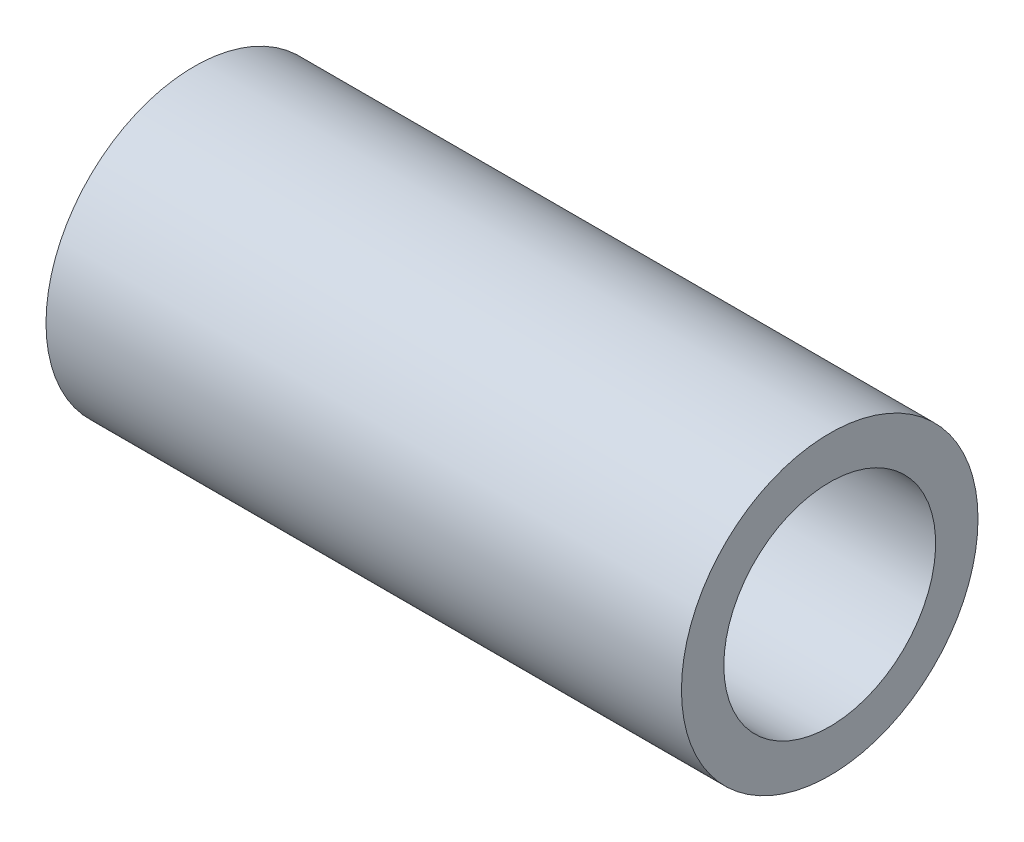
from build123d import *

# Parameters (mm, degrees)
SKIZZE1_W = 30
SKIZZE1_H = 2


with BuildPart() as part:
    # Skizze1 → Rotation1 (revolve)
    with BuildSketch(Plane.XY, mode=Mode.PRIVATE) as rotation1_sk:
        with Locations((15, 6)):
            Rectangle(SKIZZE1_W, SKIZZE1_H)
    revolve(rotation1_sk.sketch.rotate(Axis((0, 0, 0), (1, 0, 0)), 90), axis=Axis((0, 0, 0), (1, 0, 0)))


solid = part.part
